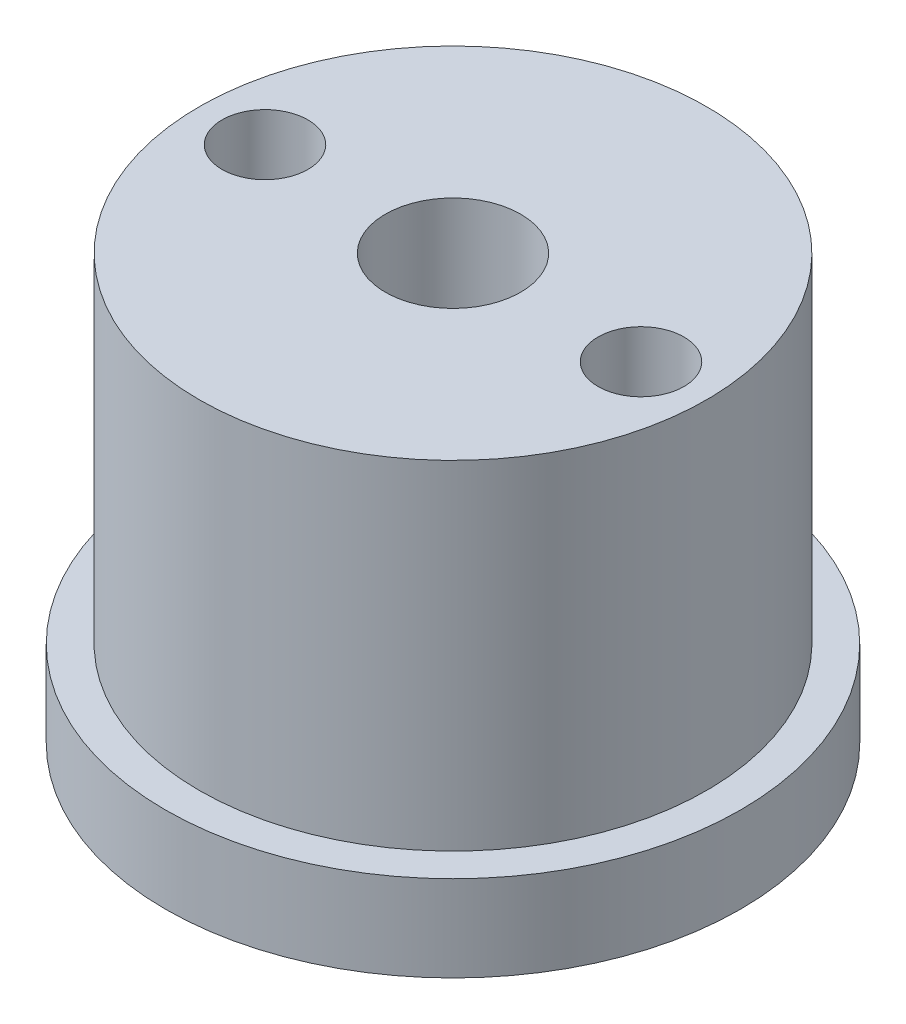
from build123d import *

# Parameters (mm, degrees)
SKETCH2_R          = 1.27
CUT_EXTRUDE1_DEPTH = 12.7
SKETCH3_R          = 2
CUT_EXTRUDE2_DEPTH = 18.37099882


with BuildPart() as part:
    # Sketch1 → Revolve1 (revolve)
    with BuildSketch(Plane.XY, mode=Mode.PRIVATE) as revolve1_sk:
        Polygon((-7.5, 0), (-8.5, 0), (-8.5, -2.54), (0, -2.54), (0, 10), (-7.5, 10), align=None)
    revolve(revolve1_sk.sketch.rotate(Axis((0, 10, 0), (0, -1, 0)), 270), axis=Axis((0, 10, 0), (0, -1, 0)))

    # Sketch2 → Cut-Extrude1 (cut)
    with BuildSketch(Plane(origin=(0, 10, 0), x_dir=(1, 0, 0), z_dir=(0, 1, 0))):
        with Locations(Location((-5.55625, 0, 0), (0, 0, 270))):
            Circle(SKETCH2_R)
        with Locations(Location((5.55625, 0, 0), (0, 0, 270))):
            Circle(SKETCH2_R)
    extrude(amount=-CUT_EXTRUDE1_DEPTH, mode=Mode.SUBTRACT)

    # Sketch3 → Cut-Extrude2 (cut, through all)
    with BuildSketch(Plane.XZ.offset(2.54)):
        with Locations(Location((0, 0, 0), (0, 0, 270))):
            Circle(SKETCH3_R)
    extrude(amount=-CUT_EXTRUDE2_DEPTH, mode=Mode.SUBTRACT)


solid = part.part
